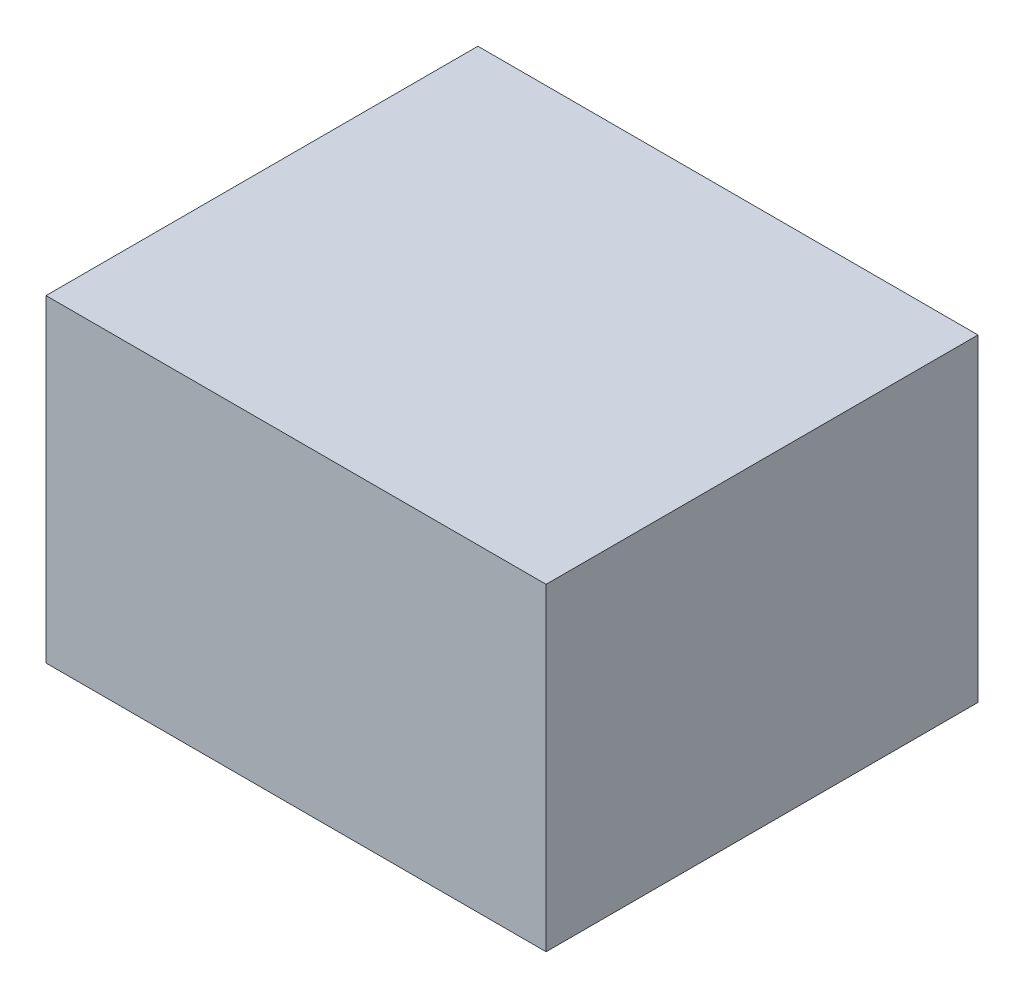
from build123d import *

# Parameters (mm, degrees)
SKETCH_2_W      = 4.4
SKETCH_2_H      = 2.8
EXTRUDE_1_DEPTH = 3.8


with BuildPart() as part:
    # Эскиз2 → Бобышка-Вытянуть1 (new body)
    with BuildSketch(Plane.XY):
        Rectangle(SKETCH_2_W, SKETCH_2_H)
    extrude(amount=EXTRUDE_1_DEPTH)


solid = part.part
